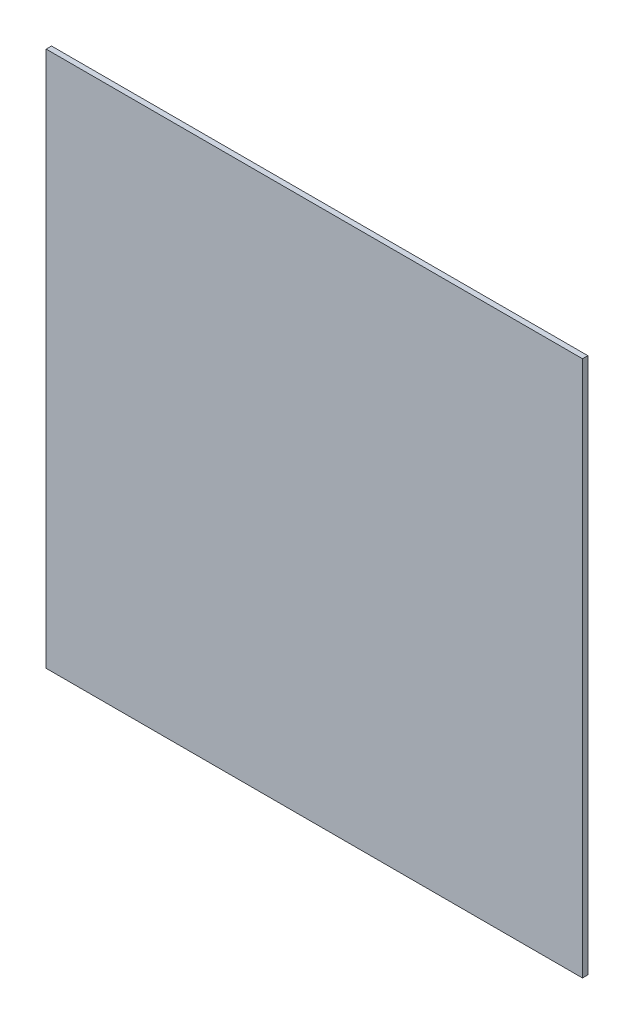
from build123d import *

# Parameters (mm, degrees)
SKETCH1_W           = 10000
SKETCH1_H           = 10000
BOSS_EXTRUDE1_DEPTH = 100


with BuildPart() as part:
    # Sketch1 → Boss-Extrude1 (new body)
    with BuildSketch(Plane(origin=(0, 0, 0), x_dir=(1, 0, 0), z_dir=(0, 0, -1))):
        with Locations((5000, -5000)):
            Rectangle(SKETCH1_W, SKETCH1_H)
    extrude(amount=BOSS_EXTRUDE1_DEPTH)


solid = part.part
